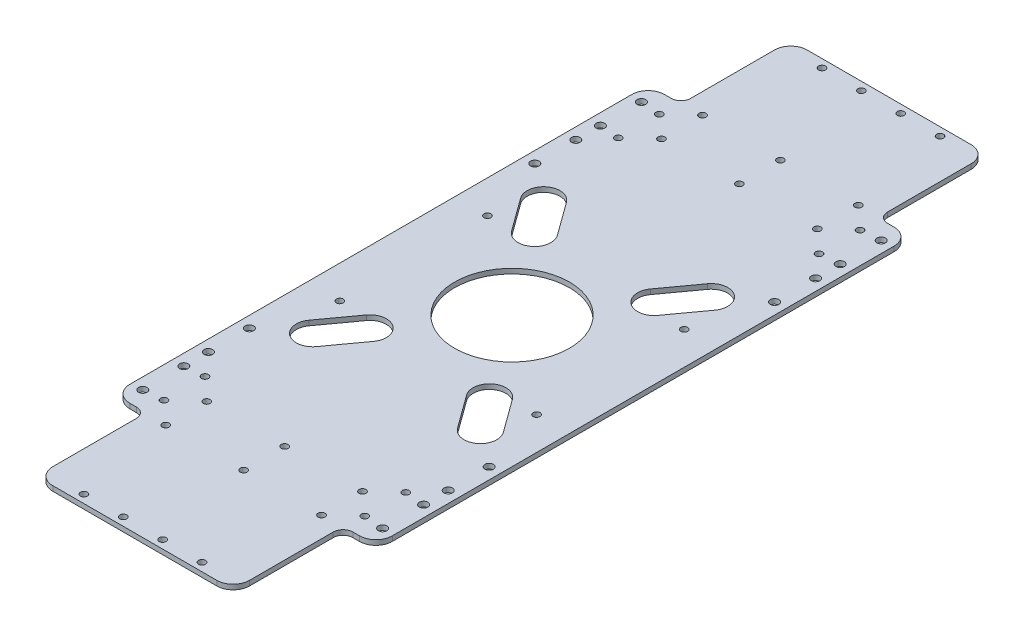
from build123d import *

# Parameters (mm, degrees)
EXTRUDE_1_DEPTH     = 3
SKETCH_2_R          = 2.6
SKETCH_2_R_2        = 35
SKETCH_2_R_3        = 2.1
CUT_EXTRUDE_1_DEPTH = 10
CUT_EXTRUDE_2_DEPTH = 10
SKETCH_8_R          = 2.1
CUT_EXTRUDE_6_DEPTH = 10
SKETCH_9_R          = 2.1
CUT_EXTRUDE_7_DEPTH = 10


with BuildPart() as part:
    # 草图1 → 凸台-拉伸1 (new body)
    with BuildSketch(Plane(origin=(0, 0, 0), x_dir=(1, 0, 0), z_dir=(0, 1, 0))):
        with BuildLine():
            Line((165, -108), (161, -108))
            ThreePointArc((161, -108), (156.757359313, -109.757359313), (155, -114))
            Line((155, -114), (155, -165))
            ThreePointArc((155, -165), (152.071067812, -172.071067812), (145, -175))
            Line((145, -175), (45, -175))
            ThreePointArc((45, -175), (37.928932188, -172.071067812), (35, -165))
            Line((35, -165), (35, -114))
            ThreePointArc((35, -114), (33.242640687, -109.757359313), (29, -108))
            Line((29, -108), (25, -108))
            ThreePointArc((25, -108), (17.928932188, -105.071067812), (15, -98))
            Line((15, -98), (15, -25))
            Line((15, -25), (15, 135))
            Line((15, 135), (15, 208))
            ThreePointArc((15, 208), (17.928932188, 215.071067812), (25, 218))
            Line((25, 218), (29, 218))
            ThreePointArc((29, 218), (33.242640687, 219.757359313), (35, 224))
            Line((35, 224), (35, 275))
            ThreePointArc((35, 275), (37.928932188, 282.071067812), (45, 285))
            Line((45, 285), (145, 285))
            ThreePointArc((145, 285), (152.071067812, 282.071067812), (155, 275))
            Line((155, 275), (155, 224))
            ThreePointArc((155, 224), (156.757359313, 219.757359313), (161, 218))
            Line((161, 218), (165, 218))
            ThreePointArc((165, 218), (172.071067812, 215.071067812), (175, 208))
            Line((175, 208), (175, 135))
            Line((175, 135), (175, -25))
            Line((175, -25), (175, -98))
            ThreePointArc((175, -98), (172.071067812, -105.071067812), (165, -108))
        make_face()
    extrude(amount=EXTRUDE_1_DEPTH)

    # 草图2 → 切除-拉伸1 (cut)
    with BuildSketch(Plane.XZ):
        with Locations(Location((168.1, 97, 0), (0, 0, 270))):
            Circle(SKETCH_2_R)
        with Locations(Location((168.1, 72, 0), (0, 0, 270))):
            Circle(SKETCH_2_R)
        with Locations(Location((168.1, 57, 0), (0, 0, 270))):
            Circle(SKETCH_2_R)
        with Locations(Location((168.1, 32, 0), (0, 0, 270))):
            Circle(SKETCH_2_R)
        with Locations(Location((95, -55, 0), (0, 0, 270))):
            Circle(SKETCH_2_R_2)
        with Locations(Location((59, 170, 0), (0, 0, 270))):
            Circle(SKETCH_2_R_3)
        with Locations(Location((83, 170, 0), (0, 0, 270))):
            Circle(SKETCH_2_R_3)
        with Locations(Location((107, 170, 0), (0, 0, 270))):
            Circle(SKETCH_2_R_3)
        with Locations(Location((131, 170, 0), (0, 0, 270))):
            Circle(SKETCH_2_R_3)
        with Locations(Location((131, -280, 0), (0, 0, 270))):
            Circle(SKETCH_2_R_3)
        with Locations(Location((107, -280, 0), (0, 0, 270))):
            Circle(SKETCH_2_R_3)
        with Locations(Location((83, -280, 0), (0, 0, 270))):
            Circle(SKETCH_2_R_3)
        with Locations(Location((59, -280, 0), (0, 0, 270))):
            Circle(SKETCH_2_R_3)
        with Locations(Location((142.5, 108.632151192, 0), (0, 0, 270))):
            Circle(SKETCH_2_R_3)
        with Locations(Location((142.5, 83.632151192, 0), (0, 0, 270))):
            Circle(SKETCH_2_R_3)
        with Locations(Location((95, 83.632151192, 0), (0, 0, 270))):
            Circle(SKETCH_2_R_3)
        with Locations(Location((95, 108.632151192, 0), (0, 0, 270))):
            Circle(SKETCH_2_R_3)
        with Locations(Location((47.5, 83.632151192, 0), (0, 0, 270))):
            Circle(SKETCH_2_R_3)
        with Locations(Location((47.5, 108.632151192, 0), (0, 0, 270))):
            Circle(SKETCH_2_R_3)
        with Locations(Location((47.5, -218.632151192, 0), (0, 0, 270))):
            Circle(SKETCH_2_R_3)
        with Locations(Location((47.5, -193.632151192, 0), (0, 0, 270))):
            Circle(SKETCH_2_R_3)
        with Locations(Location((95, -218.632151192, 0), (0, 0, 270))):
            Circle(SKETCH_2_R_3)
        with Locations(Location((95, -193.632151192, 0), (0, 0, 270))):
            Circle(SKETCH_2_R_3)
        with Locations(Location((142.5, -193.632151192, 0), (0, 0, 270))):
            Circle(SKETCH_2_R_3)
        with Locations(Location((142.5, -218.632151192, 0), (0, 0, 270))):
            Circle(SKETCH_2_R_3)
        with Locations(Location((21.9, 32, 0), (0, 0, 270))):
            Circle(SKETCH_2_R)
        with Locations(Location((21.9, 57, 0), (0, 0, 270))):
            Circle(SKETCH_2_R)
        with Locations(Location((21.9, 72, 0), (0, 0, 270))):
            Circle(SKETCH_2_R)
        with Locations(Location((21.9, 97, 0), (0, 0, 270))):
            Circle(SKETCH_2_R)
        with Locations(Location((21.9, -207, 0), (0, 0, 270))):
            Circle(SKETCH_2_R)
        with Locations(Location((21.9, -182, 0), (0, 0, 270))):
            Circle(SKETCH_2_R)
        with Locations(Location((21.9, -167, 0), (0, 0, 270))):
            Circle(SKETCH_2_R)
        with Locations(Location((21.9, -142, 0), (0, 0, 270))):
            Circle(SKETCH_2_R)
        with Locations(Location((168.1, -142, 0), (0, 0, 270))):
            Circle(SKETCH_2_R)
        with Locations(Location((168.1, -167, 0), (0, 0, 270))):
            Circle(SKETCH_2_R)
        with Locations(Location((168.1, -182, 0), (0, 0, 270))):
            Circle(SKETCH_2_R)
        with Locations(Location((168.1, -207, 0), (0, 0, 270))):
            Circle(SKETCH_2_R)
    extrude(amount=-CUT_EXTRUDE_1_DEPTH, mode=Mode.SUBTRACT)

    # 草图3 → 切除-拉伸2 (cut)
    with BuildSketch(Plane.XZ):
        with BuildLine():
            Line((35.772513107, -119.506625988), (50.467144414, -99.281201128))
            ThreePointArc((50.467144414, -99.281201128), (64.435166881, -97.068883707), (66.647484302, -111.036906174))
            Line((66.647484302, -111.036906174), (51.952852994, -131.262331034))
            ThreePointArc((51.952852994, -131.262331034), (37.984830528, -133.474648454), (35.772513107, -119.506625988))
        make_face()
        with BuildLine():
            Line((51.952852994, 21.262331034), (66.647484302, 1.036906174))
            ThreePointArc((66.647484302, 1.036906174), (64.435166881, -12.931116293), (50.467144414, -10.718798872))
            Line((50.467144414, -10.718798872), (35.772513107, 9.506625988))
            ThreePointArc((35.772513107, 9.506625988), (37.984830528, 23.474648454), (51.952852994, 21.262331034))
        make_face()
        with BuildLine():
            Line((154.227486893, 9.506625988), (139.532855586, -10.718798872))
            ThreePointArc((139.532855586, -10.718798872), (125.564833119, -12.931116293), (123.352515698, 1.036906174))
            Line((123.352515698, 1.036906174), (138.047147006, 21.262331034))
            ThreePointArc((138.047147006, 21.262331034), (152.015169472, 23.474648454), (154.227486893, 9.506625988))
        make_face()
        with BuildLine():
            Line((138.047147006, -131.262331034), (123.352515698, -111.036906174))
            ThreePointArc((123.352515698, -111.036906174), (125.564833119, -97.068883707), (139.532855586, -99.281201128))
            Line((139.532855586, -99.281201128), (154.227486893, -119.506625988))
            ThreePointArc((154.227486893, -119.506625988), (152.015169472, -133.474648454), (138.047147006, -131.262331034))
        make_face()
    extrude(amount=-CUT_EXTRUDE_2_DEPTH, mode=Mode.SUBTRACT)

    # 草图8 → 切除-拉伸6 (cut)
    with BuildSketch(Plane(origin=(0, 3, 0), x_dir=(1, 0, 0), z_dir=(0, 1, 0))):
        with Locations(Location((155, 10, 0), (0, 0, 270))):
            Circle(SKETCH_8_R)
        with Locations(Location((155, 100, 0), (0, 0, 90))):
            Circle(SKETCH_8_R)
        with Locations(Location((35, 10, 0), (0, 0, 90))):
            Circle(SKETCH_8_R)
        with Locations(Location((35, 100, 0), (0, 0, 270))):
            Circle(SKETCH_8_R)
    extrude(amount=-CUT_EXTRUDE_6_DEPTH, mode=Mode.SUBTRACT)

    # 草图9 → 切除-拉伸7 (cut)
    with BuildSketch(Plane(origin=(0, 3, 0), x_dir=(1, 0, 0), z_dir=(0, 1, 0))):
        with Locations(Location((156.2, -71, 0), (0, 0, 270))):
            Circle(SKETCH_9_R)
        with Locations(Location((156.2, -96, 0), (0, 0, 270))):
            Circle(SKETCH_9_R)
        with Locations(Location((33.8, -96, 0), (0, 0, 90))):
            Circle(SKETCH_9_R)
        with Locations(Location((33.8, -71, 0), (0, 0, 90))):
            Circle(SKETCH_9_R)
        with Locations(Location((156.2, 181, 0), (0, 0, 90))):
            Circle(SKETCH_9_R)
        with Locations(Location((156.2, 206, 0), (0, 0, 90))):
            Circle(SKETCH_9_R)
        with Locations(Location((33.8, 181, 0), (0, 0, 270))):
            Circle(SKETCH_9_R)
        with Locations(Location((33.8, 206, 0), (0, 0, 270))):
            Circle(SKETCH_9_R)
    extrude(amount=-CUT_EXTRUDE_7_DEPTH, mode=Mode.SUBTRACT)


solid = part.part
